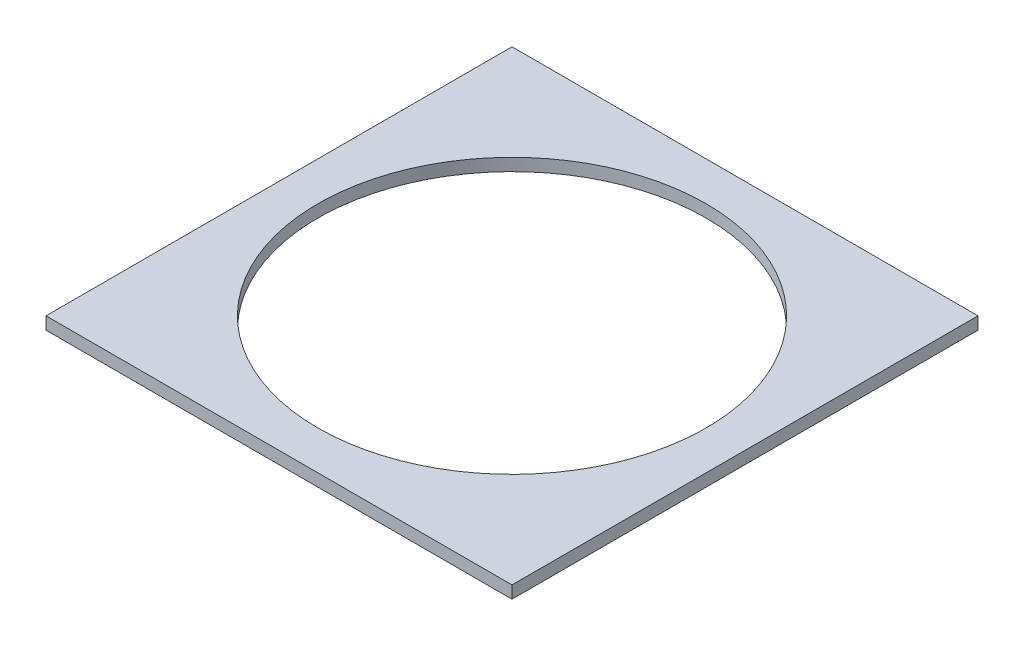
from build123d import *

# Parameters (mm, degrees)
SKETCH1_W           = 300
SKETCH1_H           = 300
BOSS_EXTRUDE1_DEPTH = 8
SKETCH2_R           = 125
CUT_EXTRUDE1_DEPTH  = 10


with BuildPart() as part:
    # Sketch1 → Boss-Extrude1 (new body)
    with BuildSketch(Plane(origin=(0, 0, 0), x_dir=(1, 0, 0), z_dir=(0, 1, 0))):
        Rectangle(SKETCH1_W, SKETCH1_H)
    extrude(amount=BOSS_EXTRUDE1_DEPTH)

    # Sketch2 → Cut-Extrude1 (cut)
    with BuildSketch(Plane(origin=(0, 8, 0), x_dir=(1, 0, 0), z_dir=(0, 1, 0))):
        with Locations(Location((0, 0, 0), (0, 0, 270))):
            Circle(SKETCH2_R)
    extrude(amount=-CUT_EXTRUDE1_DEPTH, mode=Mode.SUBTRACT)


solid = part.part
